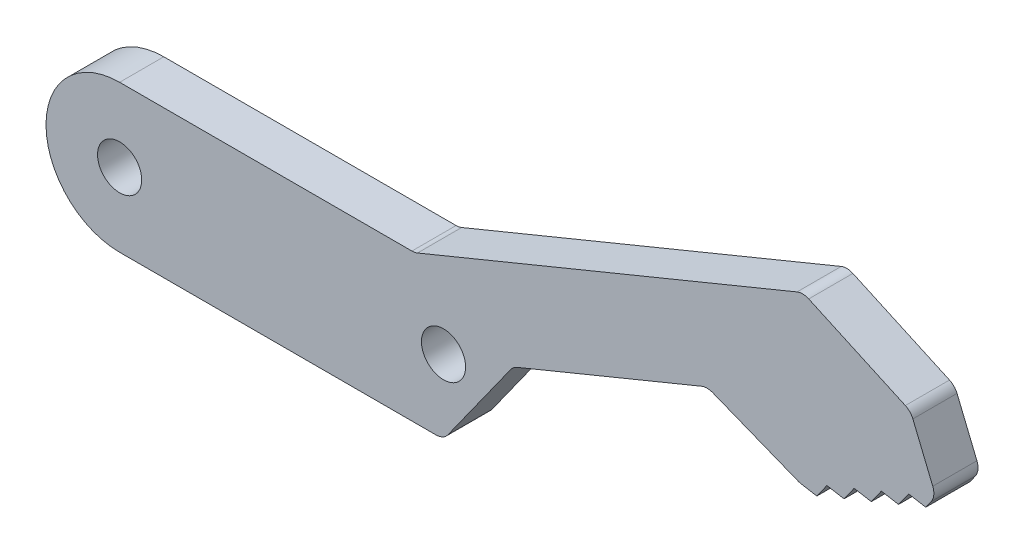
from build123d import *

# Parameters (mm, degrees)
SKETCH1_R           = 1.5
BOSS_EXTRUDE1_DEPTH = 1.5
FILLET1_R           = 1


with BuildPart() as part:
    # Sketch1 → Boss-Extrude1 (new, symmetric)
    with BuildSketch(Plane.XY):
        with BuildLine():
            Line((0, 5), (20.05, 5))
            Line((20.05, 5), (46.409029503, 15.837507263))
            Line((46.409029503, 15.837507263), (53.72608495, 12.504593197))
            Line((53.72608495, 12.504593197), (55.437270307, 8.34264117))
            Line((55.437270307, 8.34264117), (54.751958029, 7.379704473))
            Line((54.751958029, 7.379704473), (53.587513851, 7.582114344))
            Line((53.587513851, 7.582114344), (52.902201573, 6.619177648))
            Line((52.902201573, 6.619177648), (51.737757394, 6.821587519))
            Line((51.737757394, 6.821587519), (51.052445116, 5.858650822))
            Line((51.052445116, 5.858650822), (49.888000938, 6.061060693))
            Line((49.888000938, 6.061060693), (49.20268866, 5.098123997))
            Line((49.20268866, 5.098123997), (48.038244482, 5.300533868))
            Line((48.038244482, 5.300533868), (47.352932204, 4.337597171))
            Line((47.352932204, 4.337597171), (46.188488025, 4.540007042))
            Line((46.188488025, 4.540007042), (39.900164389, 7.036080522))
            Line((39.900164389, 7.036080522), (26.72989842, 1.621129525))
            Line((26.72989842, 1.621129525), (22, -5))
            Line((22, -5), (0, -5))
            ThreePointArc((0, -5), (-5, 0), (0, 5))
        make_face()
        Circle(SKETCH1_R, mode=Mode.SUBTRACT)
        with Locations((22, 0)):
            Circle(SKETCH1_R, mode=Mode.SUBTRACT)
    extrude(amount=BOSS_EXTRUDE1_DEPTH, both=True)

    # Fillet1
    fillet1_edges = [part.edges().sort_by_distance(p)[0] for p in [
        (46.188488025, 4.540007042, 0),
        (39.900164389, 7.036080522, 0),
        (26.72989842, 1.621129525, 0),
        (22, -5, 0),
        (20.05, 5, 0),
        (46.409029503, 15.837507263, 0),
        (53.72608495, 12.504593197, 0),
        (55.437270307, 8.34264117, 0),
    ]]
    fillet(fillet1_edges, radius=FILLET1_R)


solid = part.part
